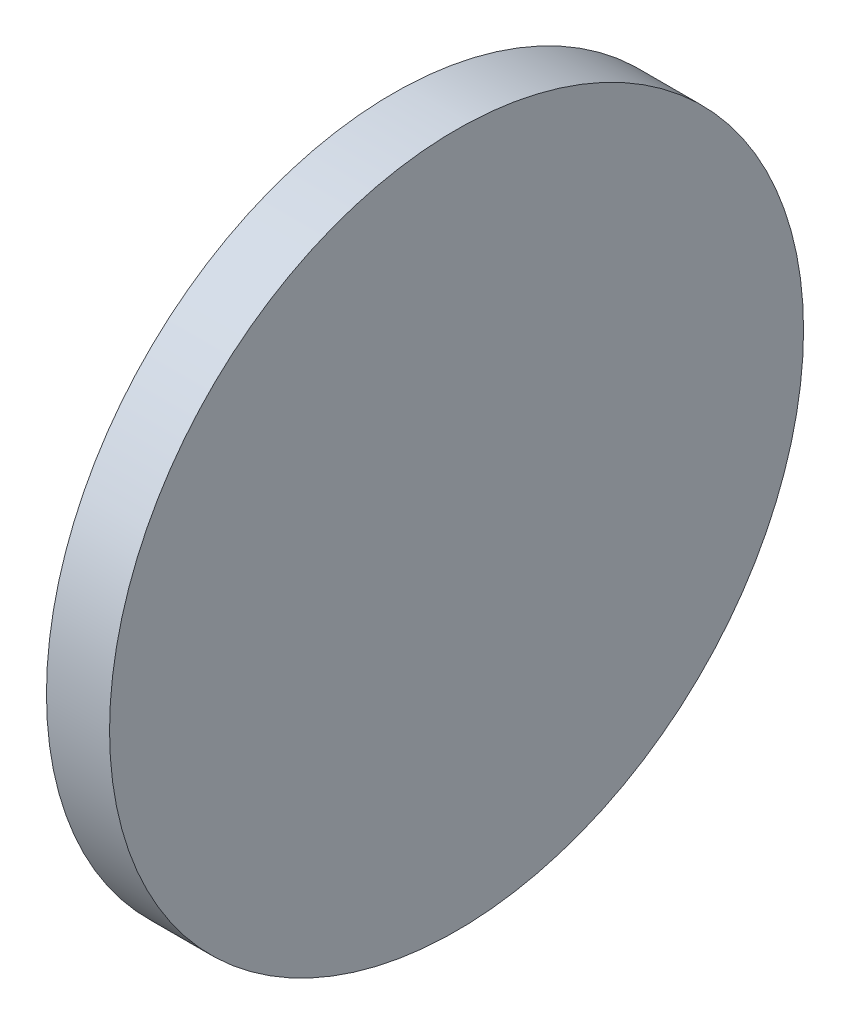
from build123d import *

# Parameters (mm, degrees)
SKETCH1_R           = 11
BOSS_EXTRUDE1_DEPTH = 2


with BuildPart() as part:
    # Sketch1 → Boss-Extrude1 (new body)
    with BuildSketch(Plane(origin=(0, 0, 0), x_dir=(0, 0, -1), z_dir=(1, 0, 0))):
        Circle(SKETCH1_R)
    extrude(amount=BOSS_EXTRUDE1_DEPTH)


solid = part.part
